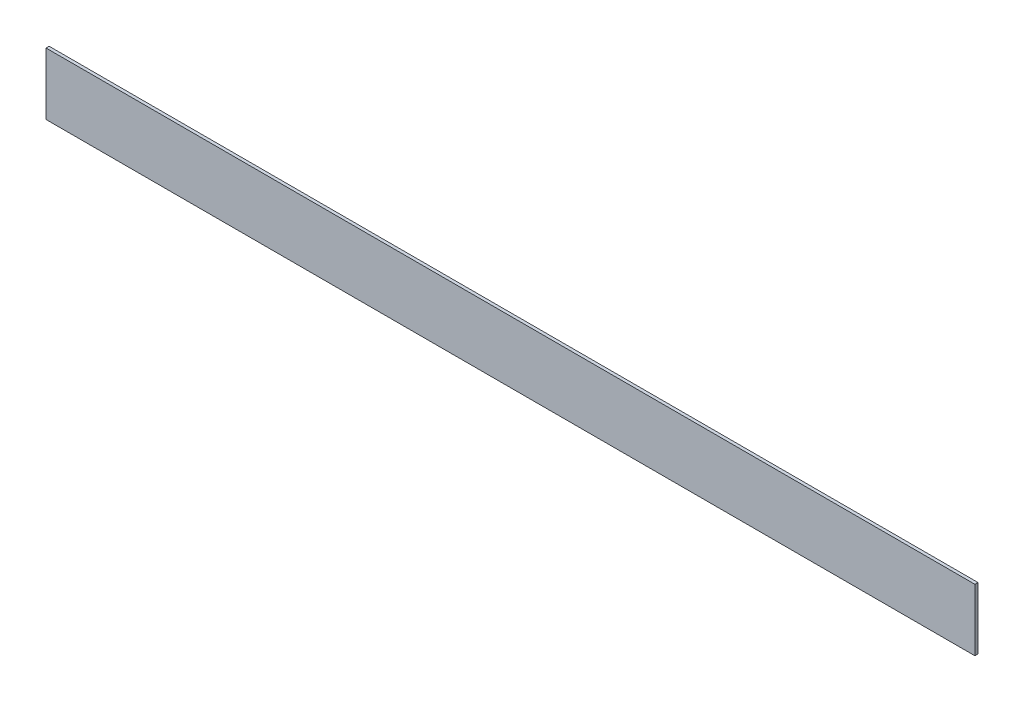
from build123d import *

# Parameters (mm, degrees)
SKETCH1_W           = 3000
SKETCH1_H           = 200
BOSS_EXTRUDE1_DEPTH = 10


with BuildPart() as part:
    # Sketch1 → Boss-Extrude1 (new body)
    with BuildSketch(Plane.XY):
        Rectangle(SKETCH1_W, SKETCH1_H)
    extrude(amount=BOSS_EXTRUDE1_DEPTH)


solid = part.part
